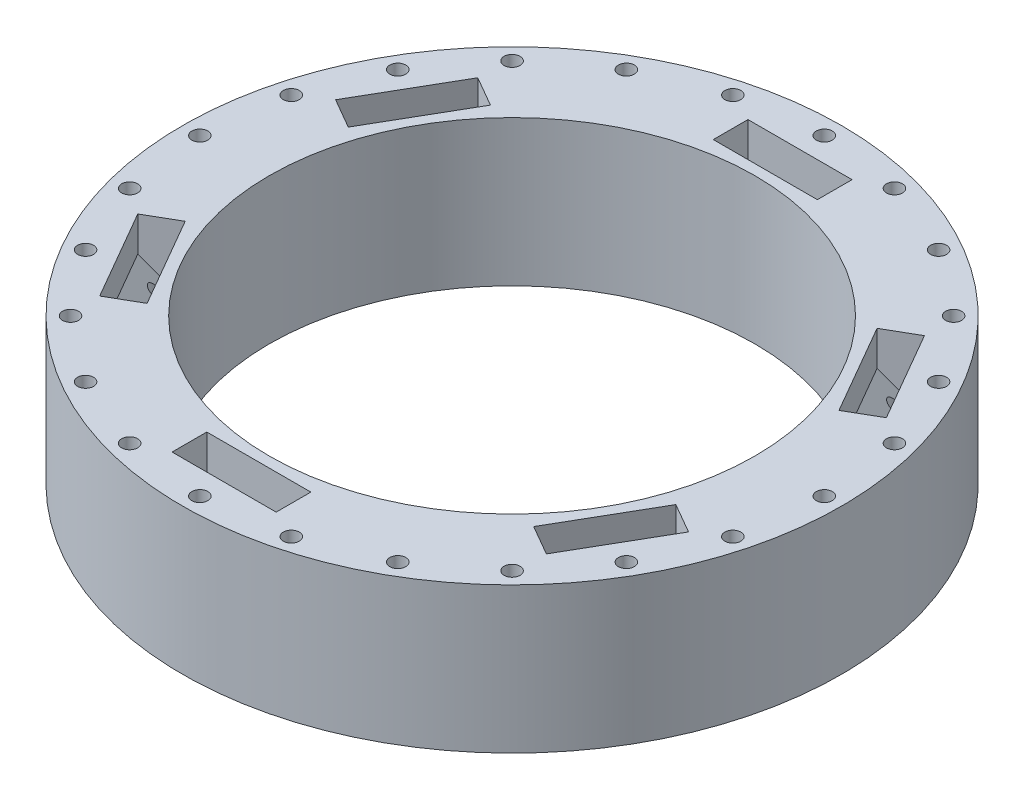
from build123d import *

# Parameters (mm, degrees)
SKETCH1_R             = 95
SKETCH1_R_2           = 70
BOSS_EXTRUDE1_DEPTH   = 42
CUT_EXTRUDE3_DEPTH    = 15
CIRPATTERN2_COUNT     = 6
M3_CLEARANCE_HOLE1_D  = 3.2
F_5_0MM_DOWEL_SLOT1_D = 4.6


with BuildPart() as part:
    # Sketch1 → Boss-Extrude1 (new body)
    with BuildSketch(Plane(origin=(0, 0, 0), x_dir=(1, 0, 0), z_dir=(0, 1, 0))):
        with Locations(Location((0, 0, 0), (0, 0, 90))):
            Circle(SKETCH1_R)
        with Locations(Location((0, 0, 0), (0, 0, 90))):
            Circle(SKETCH1_R_2, mode=Mode.SUBTRACT)
    extrude(amount=BOSS_EXTRUDE1_DEPTH)

    # Sketch7 → Cut-Extrude3 (cut, symmetric)
    with BuildSketch(Plane(origin=(0, 0, 0), x_dir=(0, -1, 0), z_dir=(-0.500000000000001, 0, 0.866025403784438))):
        Polygon((-42, 83), (-32, 83), (-27, 78), (-32, 73), (-42, 73), align=None)
        Polygon((-10, 83), (0, 83), (0, 73), (-10, 73), (-15, 78), align=None)
    cut_extrude3 = extrude(amount=CUT_EXTRUDE3_DEPTH, both=True, mode=Mode.SUBTRACT)

    # CirPattern2: Cut-Extrude3 ×6 about axis
    cirpattern2_axis = Axis((0, 0, 0), (0, 1, 0))
    for i in range(1, CIRPATTERN2_COUNT):
        add(cut_extrude3.rotate(cirpattern2_axis, i * 360 / CIRPATTERN2_COUNT), mode=Mode.SUBTRACT)

    # M3 Clearance Hole1 (through all)
    with Locations(Plane(origin=(0, 42, 0), x_dir=(1, 0, 0), z_dir=(0, 1, 0))):
        with Locations((62.549981495, -47.660254038), (72.549981495, -30.339745962), (-10, -78), (10, -78), (-72.549981495, -30.339745962), (-62.549981495, -47.660254038), (-62.549981495, 47.660254038), (-72.549981495, 30.339745962), (10, 78), (-10, 78), (72.549981495, 30.339745962), (62.549981495, 47.660254038), (0, 0)):
            Hole(M3_CLEARANCE_HOLE1_D / 2)

    # Ø5.0mm Dowel Slot1 (through all)
    with Locations(Plane(origin=(0, 42, 0), x_dir=(1, 0, 0), z_dir=(0, 1, 0))):
        with Locations((0, 90), (23.293714059, 86.933324366), (45, 77.942286341), (63.639610307, 63.639610307), (77.942286341, 45), (86.933324366, 23.293714059), (90, 0), (86.933324366, -23.293714059), (77.942286341, -45), (63.639610307, -63.639610307), (45, -77.942286341), (23.293714059, -86.933324366), (0, -90), (-23.293714059, -86.933324366), (-45, -77.942286341), (-63.639610307, -63.639610307), (-77.942286341, -45), (-86.933324366, -23.293714059), (-90, 0), (-86.933324366, 23.293714059), (-77.942286341, 45), (-63.639610307, 63.639610307), (-45, 77.942286341), (-23.293714059, 86.933324366), (0, 0)):
            Hole(F_5_0MM_DOWEL_SLOT1_D / 2)


solid = part.part
